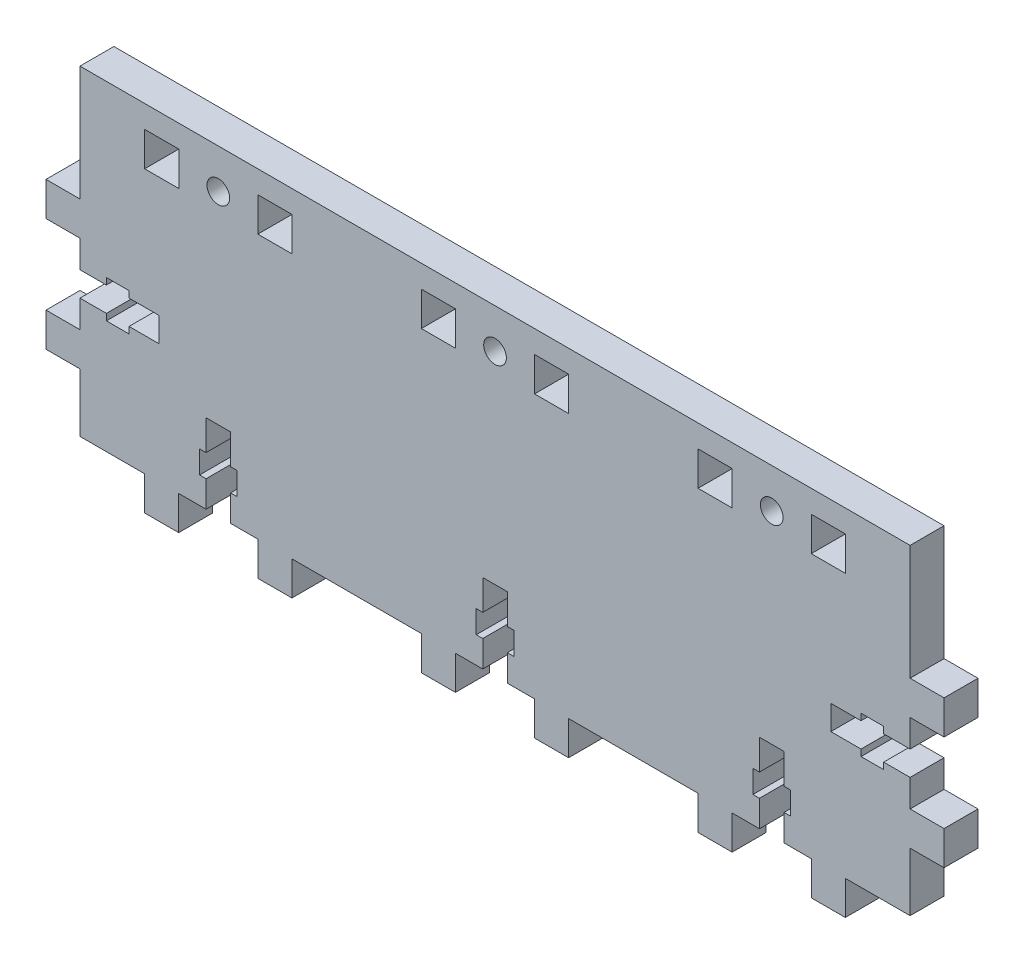
from build123d import *

# Parameters (mm, degrees)
SKETCH1_W           = 9.05
SKETCH1_H           = 9.05
SKETCH1_R           = 3
BOSS_EXTRUDE2_DEPTH = 9


with BuildPart() as part:
    # Sketch1 → Boss-Extrude2 (new body)
    with BuildSketch(Plane.XY):
        Polygon((-110, 85), (-110, 54.5), (-119, 54.5), (-119, 45.5), (-110, 45.5), (-110, 38.25), (-103, 38.25), (-103, 39.975), (-97, 39.975), (-97, 38.25), (-89, 38.25), (-89, 31.75), (-97, 31.75), (-97, 30.025), (-103, 30.025), (-103, 31.75), (-110, 31.75), (-110, 24.5), (-119, 24.5), (-119, 15.5), (-110, 15.5), (-110, 0), (-92.833333333, 0), (-92.833333333, -9), (-83.833333333, -9), (-83.833333333, 0), (-76.583333333, 0), (-76.583333333, 7), (-78.308333333, 7), (-78.308333333, 13), (-76.583333333, 13), (-76.583333333, 21), (-70.083333333, 21), (-70.083333333, 13), (-68.358333333, 13), (-68.358333333, 7), (-70.083333333, 7), (-70.083333333, 0), (-62.833333333, 0), (-62.833333333, -9), (-53.833333333, -9), (-53.833333333, 0), (-19.5, 0), (-19.5, -9), (-10.5, -9), (-10.5, 0), (-3.25, 0), (-3.25, 7), (-4.975, 7), (-4.975, 13), (-3.25, 13), (-3.25, 21), (3.25, 21), (3.25, 13), (4.975, 13), (4.975, 7), (3.25, 7), (3.25, 0), (10.5, 0), (10.5, -9), (19.5, -9), (19.5, 0), (53.833333333, 0), (53.833333333, -9), (62.833333333, -9), (62.833333333, 0), (70.083333333, 0), (70.083333333, 7), (68.358333333, 7), (68.358333333, 13), (70.083333333, 13), (70.083333333, 21), (76.583333333, 21), (76.583333333, 13), (78.308333333, 13), (78.308333333, 7), (76.583333333, 7), (76.583333333, 0), (83.833333333, 0), (83.833333333, -9), (92.833333333, -9), (92.833333333, 0), (110, 0), (110, 15.5), (119, 15.5), (119, 24.5), (110, 24.5), (110, 31.75), (103, 31.75), (103, 30.025), (97, 30.025), (97, 31.75), (89, 31.75), (89, 38.25), (97, 38.25), (97, 39.975), (103, 39.975), (103, 38.25), (110, 38.25), (110, 45.5), (119, 45.5), (119, 54.5), (110, 54.5), (110, 85), align=None)
        with Locations((-88.333333333, 74.525)):
            Rectangle(SKETCH1_W, SKETCH1_H, mode=Mode.SUBTRACT)
        with Locations((-73.333333333, 74.525)):
            Circle(SKETCH1_R, mode=Mode.SUBTRACT)
        with Locations((-58.333333333, 74.525)):
            Rectangle(SKETCH1_W, SKETCH1_H, mode=Mode.SUBTRACT)
        with Locations((-15, 74.525)):
            Rectangle(SKETCH1_W, SKETCH1_H, mode=Mode.SUBTRACT)
        with Locations((0, 74.525)):
            Circle(SKETCH1_R, mode=Mode.SUBTRACT)
        with Locations((15, 74.525)):
            Rectangle(SKETCH1_W, SKETCH1_H, mode=Mode.SUBTRACT)
        with Locations((58.333333333, 74.525)):
            Rectangle(SKETCH1_W, SKETCH1_H, mode=Mode.SUBTRACT)
        with Locations((73.333333333, 74.525)):
            Circle(SKETCH1_R, mode=Mode.SUBTRACT)
        with Locations((88.333333333, 74.525)):
            Rectangle(SKETCH1_W, SKETCH1_H, mode=Mode.SUBTRACT)
    extrude(amount=BOSS_EXTRUDE2_DEPTH)


solid = part.part
